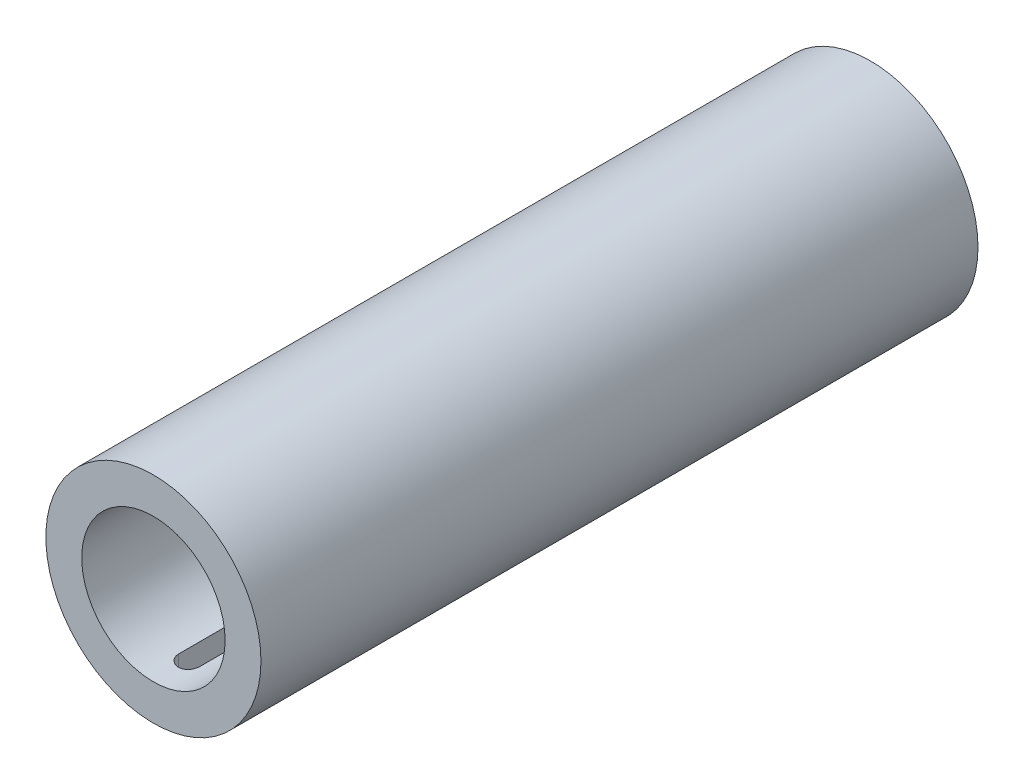
from build123d import *

# Parameters (mm, degrees)
SKETCH1_R           = 15
SKETCH1_R_2         = 10
BOSS_EXTRUDE1_DEPTH = 100
CUT_EXTRUDE1_DEPTH  = 1
CUT_EXTRUDE2_DEPTH  = 103.225241501


with BuildPart() as part:
    # Sketch1 → Boss-Extrude1 (new body)
    with BuildSketch(Plane(origin=(0, 0, 0), x_dir=(0, 1, 0), z_dir=(0, 0, 1))):
        with Locations(Location((0, 0, 0), (0, 0, 270))):
            Circle(SKETCH1_R)
        with Locations(Location((0, 0, 0), (0, 0, 270))):
            Circle(SKETCH1_R_2, mode=Mode.SUBTRACT)
    extrude(amount=BOSS_EXTRUDE1_DEPTH)

    # Sketch2 → Cut-Extrude1 (cut)
    with BuildSketch(Plane(origin=(0, 0, 0), x_dir=(-1, 0, 0), z_dir=(0, 0, -1))):
        Polygon((0, -13.732646586), (-1.577694242, -11), (1.577694242, -11), align=None)
    extrude(amount=-CUT_EXTRUDE1_DEPTH, mode=Mode.SUBTRACT)

    # Sketch4 → Cut-Extrude2 (cut, through all)
    with BuildSketch(Plane(origin=(0, 0, 0), x_dir=(-1, 0, 0), z_dir=(0, 1, 0))):
        with BuildLine():
            Line((-1.5, 20), (-1.5, 95))
            ThreePointArc((-1.5, 95), (0, 96.5), (1.5, 95))
            Line((1.5, 95), (1.5, 20))
            ThreePointArc((1.5, 20), (0, 18.5), (-1.5, 20))
        make_face()
    extrude(amount=-CUT_EXTRUDE2_DEPTH, mode=Mode.SUBTRACT)


solid = part.part
